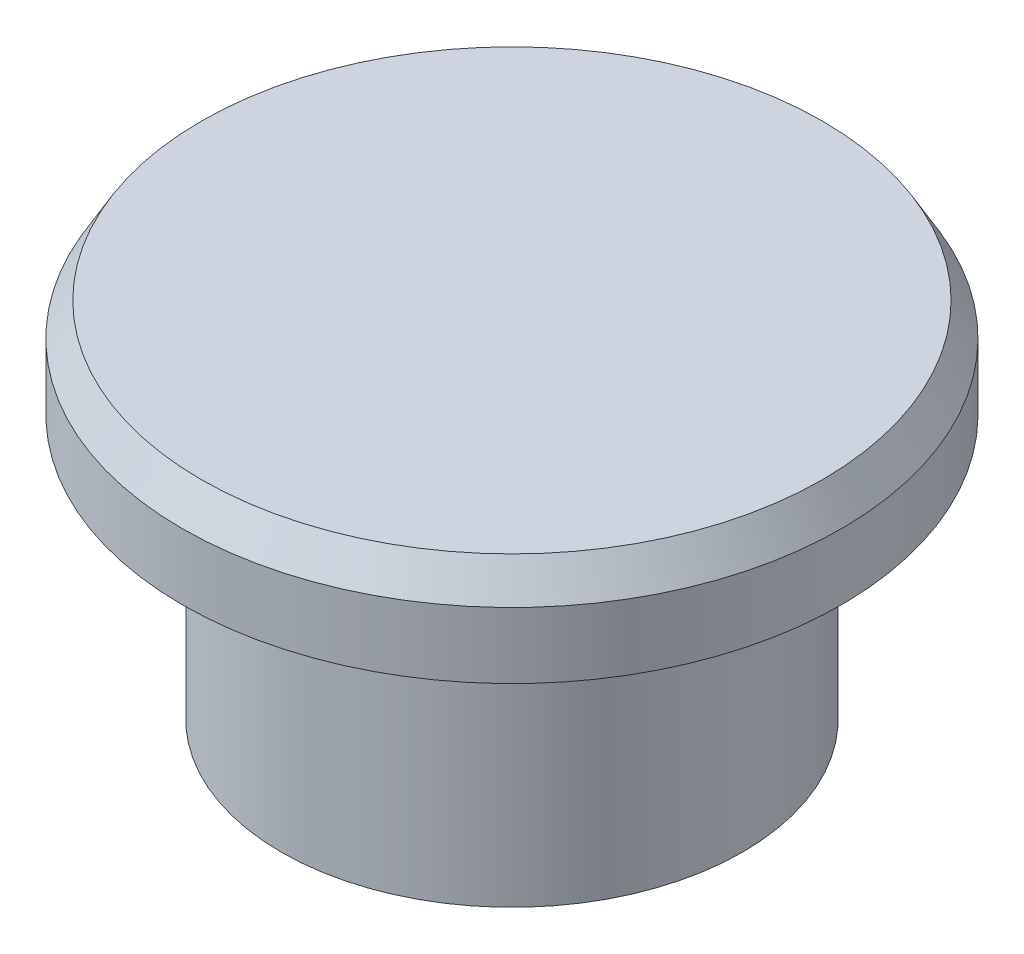
from build123d import *

# Parameters (mm, degrees)
ESQUISSE1_R        = 14
BOSS_EXTRU_1_DEPTH = 14
ESQUISSE2_R        = 10.5
BOSS_EXTRU_2_DEPTH = 2
ESQUISSE4_R        = 20
BOSS_EXTRU_3_DEPTH = 4
ESQUISSE5_R        = 20
BOSS_EXTRU_4_DEPTH = 2
CHANFREIN1_SIZE    = 2
CHANFREIN1_SIZE2   = 1.154700538


with BuildPart() as part:
    # Esquisse1 → Boss.-Extru.1 (new body)
    with BuildSketch(Plane(origin=(0, 0, 0), x_dir=(1, 0, 0), z_dir=(0, 1, 0))):
        with Locations(Location((0, 0, 0), (0, 0, 270))):
            Circle(ESQUISSE1_R)
    extrude(amount=BOSS_EXTRU_1_DEPTH)

    # Esquisse2 → Boss.-Extru.2 (add)
    with BuildSketch(Plane(origin=(0, 14, 0), x_dir=(1, 0, 0), z_dir=(0, 1, 0))):
        with Locations(Location((0, 0, 0), (0, 0, 270))):
            Circle(ESQUISSE2_R)
    extrude(amount=BOSS_EXTRU_2_DEPTH)

    # Esquisse4 → Boss.-Extru.3 (add)
    with BuildSketch(Plane(origin=(0, 16, 0), x_dir=(1, 0, 0), z_dir=(0, 1, 0))):
        with Locations(Location((0, 0, 0), (0, 0, 270))):
            Circle(ESQUISSE4_R)
    extrude(amount=BOSS_EXTRU_3_DEPTH)

    # Esquisse5 → Boss.-Extru.4 (add)
    with BuildSketch(Plane(origin=(0, 20, 0), x_dir=(1, 0, 0), z_dir=(0, 1, 0))):
        with Locations(Location((0, 0, 0), (0, 0, 270))):
            Circle(ESQUISSE5_R)
    extrude(amount=BOSS_EXTRU_4_DEPTH)

    # Chanfrein1
    chanfrein1_edges = [part.edges().sort_by_distance(p)[0] for p in [
        (0, 22, -20),
    ]]
    chanfrein1_side = [part.faces().sort_by_distance(p)[0] for p in [
        (0, 19, -20),
    ]]
    chamfer(chanfrein1_edges, length=CHANFREIN1_SIZE, length2=CHANFREIN1_SIZE2, reference=chanfrein1_side[0])


solid = part.part
